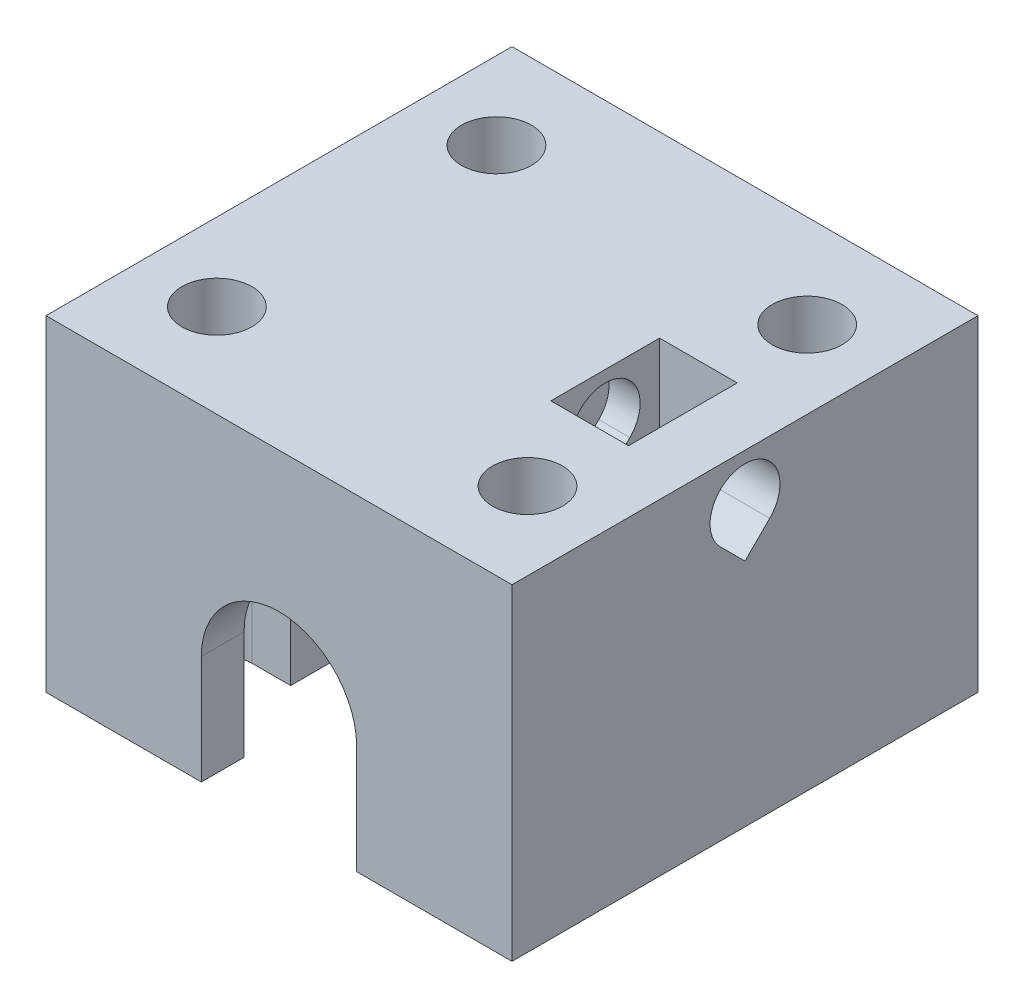
from build123d import *

# Parameters (mm, degrees)
BOSS_EXTRUDE1_DEPTH = 15
SKETCH2_R           = 2.25
CUT_EXTRUDE1_DEPTH  = 30.849623113
CUT_EXTRUDE2_START  = -15
CUT_EXTRUDE2_DEPTH  = 15
CUT_EXTRUDE3_DEPTH  = 12.25
CUT_EXTRUDE4_DEPTH  = 11
SKETCH8_W           = 5
SKETCH8_H           = 7
CUT_EXTRUDE5_DEPTH  = 8


with BuildPart() as part:
    # Sketch1 → Boss-Extrude1 (new, symmetric)
    with BuildSketch(Plane.XY):
        with BuildLine():
            Line((15, 0), (-15, 0))
            Line((-15, 0), (-15, -21))
            Line((-15, -21), (-5, -21))
            Line((-5, -21), (-5, -14))
            ThreePointArc((-5, -14), (0, -9), (5, -14))
            Line((5, -14), (5, -21))
            Line((5, -21), (15, -21))
            Line((15, -21), (15, 0))
        make_face()
    extrude(amount=BOSS_EXTRUDE1_DEPTH, both=True)

    # Sketch2 → Cut-Extrude1 (cut, through all)
    with BuildSketch(Plane(origin=(0, 0, 0), x_dir=(1, 0, 0), z_dir=(0, 1, 0))):
        with Locations((-10, 9)):
            Circle(SKETCH2_R)
        with Locations((10, 9)):
            Circle(SKETCH2_R)
        with Locations((10, -9)):
            Circle(SKETCH2_R)
        with Locations((-10, -9)):
            Circle(SKETCH2_R)
    extrude(amount=-CUT_EXTRUDE1_DEPTH, mode=Mode.SUBTRACT)

    # Sketch3 → Cut-Extrude2 (cut)
    with BuildSketch(Plane.XZ.offset(21).offset(CUT_EXTRUDE2_START)):
        with BuildLine():
            Line((-10, 11.25), (10, 11.25))
            ThreePointArc((10, 11.25), (12.25, 9), (10, 6.75))
            Line((10, 6.75), (-10, 6.75))
            ThreePointArc((-10, 6.75), (-12.25, 9), (-10, 11.25))
        make_face()
        with BuildLine():
            Line((10, -11.25), (-10, -11.25))
            ThreePointArc((-10, -11.25), (-12.25, -9), (-10, -6.75))
            Line((-10, -6.75), (10, -6.75))
            ThreePointArc((10, -6.75), (12.25, -9), (10, -11.25))
        make_face()
    extrude(amount=CUT_EXTRUDE2_DEPTH, mode=Mode.SUBTRACT)

    # Sketch4 → Cut-Extrude3 (cut, symmetric)
    with BuildSketch(Plane.XY):
        with BuildLine():
            Line((-7.5, -14), (-7.5, -21))
            Line((-7.5, -21), (7.5, -21))
            Line((7.5, -21), (7.5, -14))
            ThreePointArc((7.5, -14), (0, -6.5), (-7.5, -14))
        make_face()
    extrude(amount=CUT_EXTRUDE3_DEPTH, both=True, mode=Mode.SUBTRACT)

    # Sketch7 → Cut-Extrude4 (cut)
    with BuildSketch(Plane(origin=(15, 0, 0), x_dir=(0, 0, -1), z_dir=(1, 0, 0))):
        with BuildLine():
            Line((-1.590990258, -4.590990258), (0, -6.181980515))
            Line((0, -6.181980515), (1.590990258, -4.590990258))
            ThreePointArc((1.590990258, -4.590990258), (0, -0.75), (-1.590990258, -4.590990258))
        make_face()
    extrude(amount=-CUT_EXTRUDE4_DEPTH, mode=Mode.SUBTRACT)

    # Sketch8 → Cut-Extrude5 (cut)
    with BuildSketch(Plane(origin=(0, 0, 0), x_dir=(1, 0, 0), z_dir=(0, 1, 0))):
        with Locations((8.5, 0)):
            Rectangle(SKETCH8_W, SKETCH8_H)
    extrude(amount=-CUT_EXTRUDE5_DEPTH, mode=Mode.SUBTRACT)


solid = part.part
